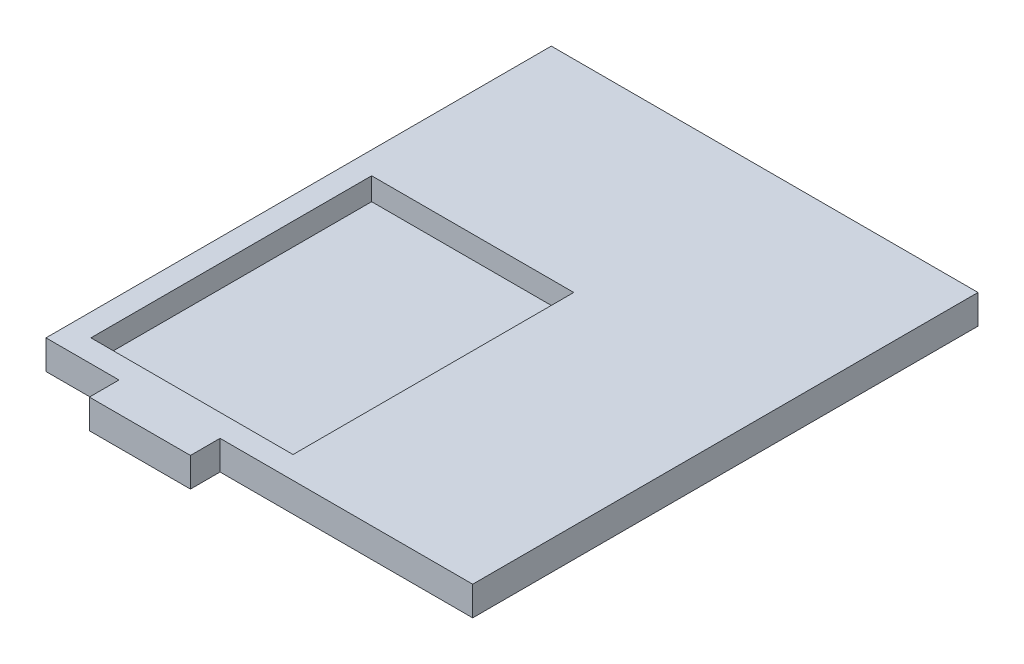
from build123d import *

# Parameters (mm, degrees)
BOSS_EXTRUDE1_DEPTH = 3
BOSS_EXTRUDE2_DEPTH = 10


with BuildPart() as part:
    # Sketch1 → Boss-Extrude1 (new body)
    with BuildSketch(Plane(origin=(0, 0, 0), x_dir=(1, 0, 0), z_dir=(0, 1, 0))):
        Polygon((-10, 215), (-10, -10), (22.5, -10), (22.5, -23.183655632), (67.5, -23.183655632), (67.5, -10), (180, -10), (180, 215), align=None)
    extrude(amount=-BOSS_EXTRUDE1_DEPTH)

    # Sketch1<3> → Boss-Extrude2 (add)
    with BuildSketch(Plane(origin=(0, 0, 0), x_dir=(1, 0, 0), z_dir=(0, 1, 0))):
        Polygon((-10, -10), (22.5, -10), (22.5, -23.183655632), (67.5, -23.183655632), (67.5, -10), (180, -10), (180, 215), (-10, 215), align=None)
        Polygon((90, 0), (45, 0), (0, 0), (0, 125), (90, 125), align=None, mode=Mode.SUBTRACT)
    extrude(amount=BOSS_EXTRUDE2_DEPTH)


solid = part.part
